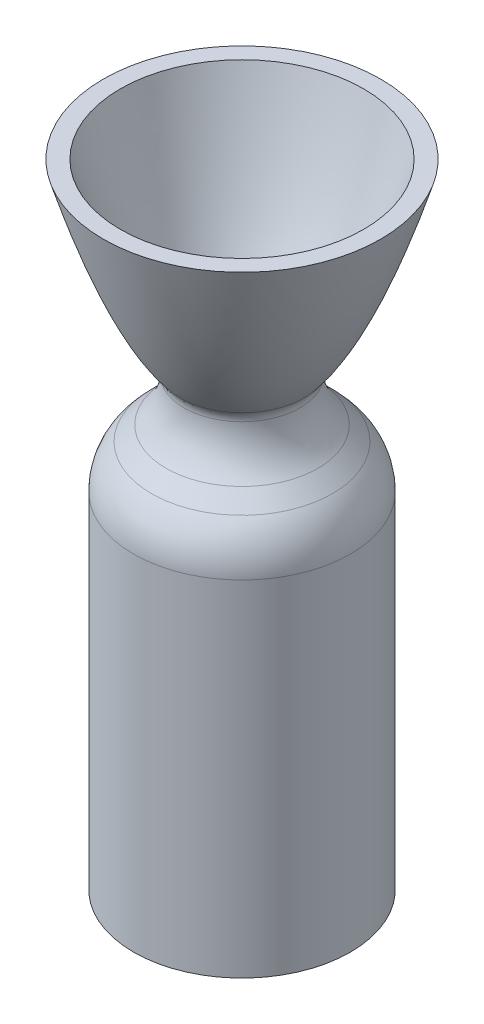
from build123d import *


with BuildPart() as part:
    # Sketch1 → Revolve2 (revolve)
    with BuildSketch(Plane.XY, mode=Mode.PRIVATE) as revolve2_sk:
        with BuildLine():
            Line((71.727523603, 109.92750764), (81.727523603, 109.92750764))
            add(Edge.make_bspline(
                [(36.834819916, 6.492229985), (59.290187444, 34.627531396), (81.727523603, 109.92750764)],
                knots=[0, 0, 0, 1, 1, 1], degree=2))
            add(Edge.make_bspline(
                [(34.138608587, -0.017009666), (34.138609214, 0.018882986), (34.139147045, 0.093104024), (34.141564436, 0.250631404), (34.148002281, 0.410054451), (34.160074312, 0.629754601), (34.1809758, 0.884423662), (34.214725432, 1.185527607), (34.266040019, 1.525040832), (34.330084415, 1.863987111), (34.406682315, 2.199344754), (34.495864285, 2.532229755), (34.597282126, 2.861082979), (34.711159784, 3.186337375), (34.836737485, 3.506617492), (34.97482669, 3.822657067), (35.123611014, 4.132272519), (35.285552936, 4.437773457), (35.456029218, 4.73429191), (35.642055434, 5.028694196), (35.831328983, 5.30850927), (36.043946188, 5.593717877), (36.218417088, 5.815903982), (36.405886469, 6.032941971), (36.544095961, 6.19163198), (36.709982784, 6.365112113), (36.784060974, 6.441469176), (36.834819916, 6.492229985)],
                knots=[0.082568816, 0.082568816, 0.082568816, 0.082568816, 0.082568816, 0.102426634, 0.122284453, 0.142142271, 0.162000089, 0.201715725, 0.241431362, 0.281146998, 0.320862634, 0.360578271, 0.400293907, 0.440009544, 0.47972518, 0.519440816, 0.559156453, 0.598872089, 0.638587725, 0.678303362, 0.718018998, 0.757734635, 0.797450271, 0.837165907, 0.857023726, 0.876881544, 0.91659718, 0.91659718, 0.91659718, 0.91659718, 0.91659718], degree=4))
            add(Edge.make_bspline(
                [(34.138608587, -0.017009666), (34.138609818, -0.087538311), (34.139138965, -0.230593854), (34.141514651, -0.56019258), (34.147839045, -0.84117006), (34.157324166, -1.211831735), (34.169966459, -1.530444722), (34.185766683, -1.878949267), (34.204721942, -2.210716536), (34.232359556, -2.635079064), (34.271827763, -3.139043611), (34.342840424, -3.896988339), (34.462667396, -4.903460052), (34.639026762, -6.073720425), (34.890425953, -7.40217608), (35.191336034, -8.72058418), (35.541311345, -10.026646874), (35.939901707, -11.318829263), (36.386486116, -12.595109002), (36.880544048, -13.853897152), (37.421213848, -15.093206797), (38.008020114, -16.311619463), (38.639680126, -17.506948464), (39.316073126, -18.678297428), (40.034985833, -19.822753069), (40.797562731, -20.940869748), (41.498707925, -21.891421434), (42.128276856, -22.690455155), (42.66366915, -23.337431814), (43.111796503, -23.857014693), (43.547990761, -24.346825923), (43.975366857, -24.805494067), (44.285099375, -25.130877988), (44.576400693, -25.426658725), (44.675953161, -25.526959611), (44.725823539, -25.576831796)],
                knots=[0.082637729, 0.082637729, 0.082637729, 0.082637729, 0.082637729, 0.092574926, 0.102512123, 0.11244932, 0.122386517, 0.132323714, 0.142260911, 0.152198108, 0.162135305, 0.182009699, 0.201884093, 0.24163288, 0.281381668, 0.321130456, 0.360879243, 0.400628031, 0.440376819, 0.480125606, 0.519874394, 0.559623181, 0.599371969, 0.639120757, 0.678869544, 0.718618332, 0.75836712, 0.798115907, 0.817990301, 0.837864695, 0.857739089, 0.877613483, 0.897487877, 0.907425074, 0.91736227, 0.91736227, 0.91736227, 0.91736227, 0.91736227], degree=4))
            Line((44.725823539, -25.576831796), (53.333451737, -34.184459994))
            add(Edge.make_bspline(
                [(63.881527661, -59.7610264), (63.881635503, -59.69049642), (63.881325305, -59.548918717), (63.879465733, -59.215073955), (63.873569156, -58.938295382), (63.864659319, -58.566053153), (63.852510889, -58.246304118), (63.833426989, -57.81503091), (63.804188899, -57.314350552), (63.760893785, -56.721321154), (63.683287498, -55.881682335), (63.584725547, -55.041214402), (63.465267047, -54.205298233), (63.29694877, -53.205026548), (63.103741076, -52.20974415), (62.879581588, -51.220492573), (62.624738161, -50.239047247), (62.345520509, -49.264202982), (62.042075875, -48.296624041), (61.652992583, -47.179186843), (61.160922285, -45.919697705), (60.622053077, -44.679423275), (60.037264966, -43.460250184), (59.407173995, -42.26366605), (58.732990621, -41.091683685), (58.01511276, -39.945389917), (57.255467534, -38.827317395), (56.553708501, -37.873606552), (55.928608775, -37.07685924), (55.388897912, -36.423732973), (54.951995062, -35.913923057), (54.552336448, -35.466049487), (54.21957854, -35.103172981), (53.912547535, -34.778406745), (53.713018445, -34.569307229), (53.483698764, -34.335919152), (53.383246704, -34.234409452), (53.333451737, -34.184459994)],
                knots=[0.082637729, 0.082637729, 0.082637729, 0.082637729, 0.082637729, 0.092574926, 0.102512123, 0.11244932, 0.122386517, 0.132323714, 0.142260911, 0.162135305, 0.182009699, 0.201884093, 0.24163288, 0.261507274, 0.281381668, 0.321130456, 0.360879243, 0.380753637, 0.400628031, 0.440376819, 0.480125606, 0.519874394, 0.559623181, 0.599371969, 0.639120757, 0.678869544, 0.718618332, 0.75836712, 0.798115907, 0.817990301, 0.837864695, 0.857739089, 0.877613483, 0.88755068, 0.897487877, 0.907425074, 0.91736227, 0.91736227, 0.91736227, 0.91736227, 0.91736227], degree=4))
            Line((63.881527661, -59.7610264), (63.881527661, -262.944683548))
            Line((63.881527661, -262.944683548), (53.881527661, -262.927513222))
            Line((53.881527661, -262.927513222), (53.881527661, -59.727513222))
            add(Edge.make_bspline(
                [(53.881527661, -59.727513222), (53.88152643, -59.656983159), (53.880997287, -59.515406106), (53.878621437, -59.181564619), (53.872296838, -58.904795496), (53.862811351, -58.532567491), (53.850168453, -58.212837625), (53.830417626, -57.781594446), (53.800405285, -57.280959902), (53.756193122, -56.687998168), (53.677288452, -55.848480369), (53.577426862, -55.008165863), (53.456675787, -54.172435433), (53.286810823, -53.172425243), (53.092064187, -52.177442824), (52.866375121, -51.188539086), (52.610014225, -50.207489041), (52.329289341, -49.233077743), (52.02434874, -48.265969226), (51.633537832, -47.14913507), (51.139520362, -45.890408408), (50.598733754, -44.650968806), (50.012060929, -43.432701529), (49.380120232, -42.237093242), (48.70412523, -41.066154882), (47.984475521, -39.92097266), (47.223102139, -38.804076242), (46.519869062, -37.851451787), (45.893537939, -37.055672125), (45.352817682, -36.403381284), (44.91512695, -35.894247635), (44.514776192, -35.446992659), (44.181457505, -35.084631187), (43.873924626, -34.760340153), (43.674072408, -34.551549453), (43.444392075, -34.31851629), (43.343783153, -34.217162057), (43.293911001, -34.167289665)],
                knots=[0.082637729, 0.082637729, 0.082637729, 0.082637729, 0.082637729, 0.092574926, 0.102512123, 0.11244932, 0.122386517, 0.132323714, 0.142260911, 0.162135305, 0.182009699, 0.201884093, 0.24163288, 0.261507274, 0.281381668, 0.321130456, 0.360879243, 0.380753637, 0.400628031, 0.440376819, 0.480125606, 0.519874394, 0.559623181, 0.599371969, 0.639120757, 0.678869544, 0.718618332, 0.75836712, 0.798115907, 0.817990301, 0.837864695, 0.857739089, 0.877613483, 0.88755068, 0.897487877, 0.907425074, 0.91736227, 0.91736227, 0.91736227, 0.91736227, 0.91736227], degree=4))
            Line((43.293911001, -34.167289665), (34.686282803, -25.559661467))
            add(Edge.make_bspline(
                [(24.099067874, 0.000160672), (24.099069105, -0.070367973), (24.099598252, -0.213423516), (24.101973937, -0.543022242), (24.108298331, -0.823999723), (24.117783452, -1.194661397), (24.130425744, -1.513274384), (24.146225968, -1.861778929), (24.165181227, -2.193546198), (24.19281884, -2.617908726), (24.232287047, -3.121873273), (24.303299707, -3.879818001), (24.423126678, -4.886289715), (24.599486044, -6.056550087), (24.850885233, -7.385005742), (25.151795313, -8.703413843), (25.501770623, -10.009476538), (25.900360983, -11.301658927), (26.346945391, -12.577938666), (26.841003322, -13.836726816), (27.381673121, -15.076036462), (27.968479386, -16.294449129), (28.600139397, -17.48977813), (29.276532395, -18.661127095), (29.995445101, -19.805582736), (30.758021999, -20.923699416), (31.459167192, -21.874251103), (32.088736123, -22.673284825), (32.624128416, -23.320261484), (33.072255768, -23.839844363), (33.508450026, -24.329655594), (33.935826121, -24.788323738), (34.245558639, -25.11370766), (34.536859957, -25.409488397), (34.636412425, -25.509789282), (34.686282803, -25.559661467)],
                knots=[0.082637729, 0.082637729, 0.082637729, 0.082637729, 0.082637729, 0.092574926, 0.102512123, 0.11244932, 0.122386517, 0.132323714, 0.142260911, 0.152198108, 0.162135305, 0.182009699, 0.201884093, 0.24163288, 0.281381668, 0.321130456, 0.360879243, 0.400628031, 0.440376819, 0.480125606, 0.519874394, 0.559623181, 0.599371969, 0.639120757, 0.678869544, 0.718618332, 0.75836712, 0.798115907, 0.817990301, 0.837864695, 0.857739089, 0.877613483, 0.897487877, 0.907425074, 0.91736227, 0.91736227, 0.91736227, 0.91736227, 0.91736227], degree=4))
            add(Edge.make_bspline(
                [(24.099067874, 0.000160672), (24.0990685, 0.036053324), (24.099606331, 0.110274362), (24.102023723, 0.267801742), (24.108461568, 0.427224789), (24.120533599, 0.646924939), (24.141435087, 0.901594), (24.175184719, 1.202697945), (24.226499305, 1.54221117), (24.290543701, 1.881157449), (24.367141601, 2.216515092), (24.456323571, 2.549400093), (24.557741413, 2.878253317), (24.671619071, 3.203507713), (24.797196771, 3.523787829), (24.935285977, 3.839827405), (25.084070301, 4.149442857), (25.246012222, 4.454943795), (25.416488505, 4.751462248), (25.602514721, 5.045864533), (25.79178827, 5.325679608), (26.004405474, 5.610888215), (26.178876374, 5.83307432), (26.366345756, 6.050112309), (26.504555248, 6.208802318), (26.67044207, 6.382282451), (26.744520261, 6.458639514), (26.795279203, 6.509400323)],
                knots=[0.082568816, 0.082568816, 0.082568816, 0.082568816, 0.082568816, 0.102426634, 0.122284453, 0.142142271, 0.162000089, 0.201715725, 0.241431362, 0.281146998, 0.320862634, 0.360578271, 0.400293907, 0.440009544, 0.47972518, 0.519440816, 0.559156453, 0.598872089, 0.638587725, 0.678303362, 0.718018998, 0.757734635, 0.797450271, 0.837165907, 0.857023726, 0.876881544, 0.91659718, 0.91659718, 0.91659718, 0.91659718, 0.91659718], degree=4))
            add(Edge.make_bspline(
                [(26.795279203, 6.509400323), (49.261401403, 34.636114842), (71.727523603, 109.92750764)],
                knots=[0, 0, 0, 1, 1, 1], degree=2))
        make_face()
    revolve(revolve2_sk.sketch.rotate(Axis((-0.005532126, 165.815985114, 0), (0, -1, 0)), 180), axis=Axis((-0.005532126, 165.815985114, 0), (0, -1, 0)))


solid = part.part
